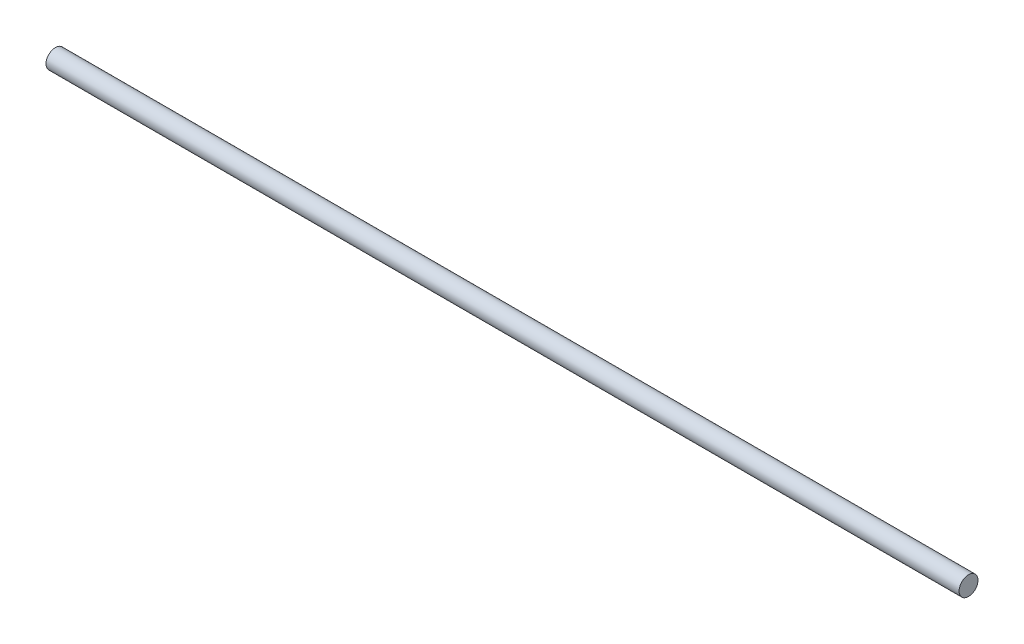
from build123d import *

# Parameters (mm, degrees)
SKETCH_1_R      = 3
EXTRUDE_1_DEPTH = 290


with BuildPart() as part:
    # 草图1 → 凸台-拉伸1 (new body)
    with BuildSketch(Plane(origin=(0, 0, 0), x_dir=(0, 0, -1), z_dir=(1, 0, 0))):
        Circle(SKETCH_1_R)
    extrude(amount=EXTRUDE_1_DEPTH)


solid = part.part
